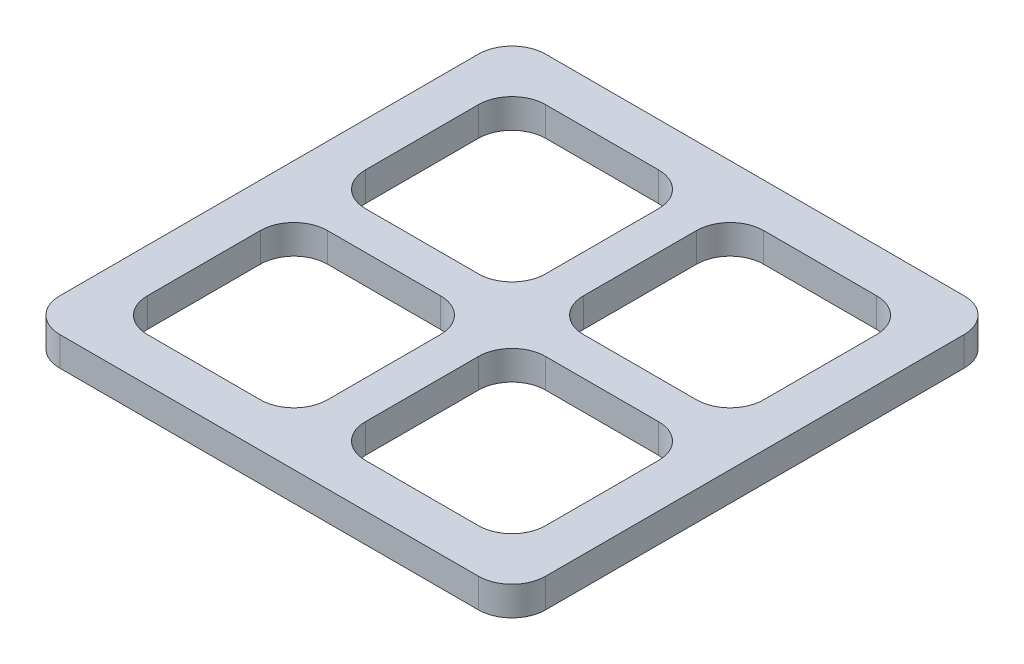
from build123d import *

# Parameters (mm, degrees)
SKETCH1_W           = 16.65
SKETCH1_H           = 16.65
SKETCH1_W_2         = 13.65
SKETCH1_H_2         = 13.65
SKETCH1_W_3         = 6.175
SKETCH1_H_3         = 1.3
SKETCH1_W_4         = 1.3
SKETCH1_H_4         = 6.175
BOSS_EXTRUDE1_DEPTH = 1
FILLET1_R           = 1.15


with BuildPart() as part:
    # Sketch1 → Boss-Extrude1 (new body)
    # profile 1 of 6: a face of its own
    with BuildSketch(Plane(origin=(0, 0, 0), x_dir=(1, 0, 0), z_dir=(0, 1, 0))):
        Rectangle(SKETCH1_W, SKETCH1_H)
        Rectangle(SKETCH1_W_2, SKETCH1_H_2, mode=Mode.SUBTRACT)
    # profile 2 of 6: a face of its own
    with BuildSketch(Plane(origin=(0, 0, 0), x_dir=(1, 0, 0), z_dir=(0, 1, 0))):
        with Locations((-3.7375, 0)):
            Rectangle(SKETCH1_W_3, SKETCH1_H_3)
    # profile 3 of 6: a face of its own
    with BuildSketch(Plane(origin=(0, 0, 0), x_dir=(1, 0, 0), z_dir=(0, 1, 0))):
        Rectangle(SKETCH1_W_4, SKETCH1_H_3)
    # profile 4 of 6: a face of its own
    with BuildSketch(Plane(origin=(0, 0, 0), x_dir=(1, 0, 0), z_dir=(0, 1, 0))):
        with Locations((0, -3.7375)):
            Rectangle(SKETCH1_W_4, SKETCH1_H_4)
    # profile 5 of 6: a face of its own
    with BuildSketch(Plane(origin=(0, 0, 0), x_dir=(1, 0, 0), z_dir=(0, 1, 0))):
        with Locations((3.7375, 0)):
            Rectangle(SKETCH1_W_3, SKETCH1_H_3)
    # profile 6 of 6: a face of its own
    with BuildSketch(Plane(origin=(0, 0, 0), x_dir=(1, 0, 0), z_dir=(0, 1, 0))):
        with Locations((0, 3.7375)):
            Rectangle(SKETCH1_W_4, SKETCH1_H_4)
    extrude(amount=BOSS_EXTRUDE1_DEPTH)

    # Fillet1
    fillet1_edges = [part.edges().sort_by_distance(p)[0] for p in [
        (-6.825, 0.5, 0.65),
        (-6.825, 0.5, 6.825),
        (-0.65, 0.5, 6.825),
        (-0.65, 0.5, 0.65),
        (-8.325, 0.5, 8.325),
        (-8.325, 0.5, -8.325),
        (8.325, 0.5, -8.325),
        (8.325, 0.5, 8.325),
        (-0.65, 0.5, -6.825),
        (-6.825, 0.5, -6.825),
        (-6.825, 0.5, -0.65),
        (-0.65, 0.5, -0.65),
        (0.65, 0.5, 6.825),
        (6.825, 0.5, 6.825),
        (6.825, 0.5, 0.65),
        (0.65, 0.5, 0.65),
        (6.825, 0.5, -0.65),
        (6.825, 0.5, -6.825),
        (0.65, 0.5, -6.825),
        (0.65, 0.5, -0.65),
    ]]
    fillet(fillet1_edges, radius=FILLET1_R)


solid = part.part
